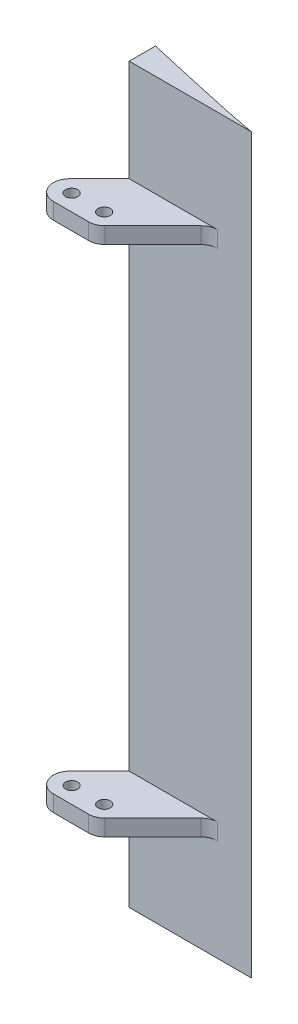
from build123d import *

# Parameters (mm, degrees)
BOSS_EXTRUDE1_DEPTH = 100
CUT_EXTRUDE4_DEPTH  = 100
SKETCH4_W           = 10
SKETCH4_H           = 2
BOSS_EXTRUDE2_DEPTH = 10
FILLET2_R           = 2
SKETCH6_R           = 0.75
CUT_EXTRUDE5_DEPTH  = 110


with BuildPart() as part:
    # Sketch1 → Boss-Extrude1 (new body)
    with BuildSketch(Plane(origin=(0, 0, 0), x_dir=(1, 0, 0), z_dir=(0, 1, 0))):
        with BuildLine():
            Line((-23.835160585, 0), (26.164839415, 0))
            add(Edge.make_bspline(
                [(-24.267578895, 1.256220546), (-22.278212262, 3.553586128), (-18.738393104, 4.793268312), (-8.850120496, 5.774851838), (4.13271293, 5.525012752), (19.211918986, 1.162580188), (26.164839415, 0)],
                knots=[0.021997225, 0.021997225, 0.021997225, 0.021997225, 0.155271246, 0.206186057, 0.531145331, 1, 1, 1, 1], degree=3))
            add(Edge.make_bspline(
                [(-24.267578895, 1.256220546), (-25.367081291, 0.124338635), (-23.835160585, 0)],
                knots=[0, 0, 0, 1, 1, 1], degree=2))
        make_face()
    extrude(amount=BOSS_EXTRUDE1_DEPTH)

    # Sketch2 → Cut-Extrude4 (cut)
    with BuildSketch(Plane.XY.offset(10)):
        Polygon((26.164839415, 95), (11.164839415, 95), (11.164839415, 5), (26.164839415, 5), (26.164839415, 0), (-24.726990199, 0), (-24.726990199, 100), (26.164839415, 100), align=None)
    extrude(amount=-CUT_EXTRUDE4_DEPTH, mode=Mode.SUBTRACT)

    # Sketch4 → Boss-Extrude2 (add, along a direction that is not the sketch's normal)
    with BuildSketch(Plane.XY):
        with Locations((16.164839415, 81.5)):
            Rectangle(SKETCH4_W, SKETCH4_H)
        with Locations((16.164839415, 18.5)):
            Rectangle(SKETCH4_W, SKETCH4_H)
    extrude(amount=BOSS_EXTRUDE2_DEPTH, dir=(-0.7071067811865557, 0, 0.7071067811865395))

    # Fillet2
    fillet2_edges = [part.edges().sort_by_distance(p)[0] for p in [
        (21.164839415, 18.5, 0),
        (14.093771603, 18.5, 7.071067812),
        (4.093771603, 18.5, 7.071067812),
        (21.164839415, 81.5, 0),
        (14.093771603, 81.5, 7.071067812),
        (4.093771603, 81.5, 7.071067812),
    ]]
    fillet(fillet2_edges, radius=FILLET2_R)

    # Sketch6 → Cut-Extrude5 (cut)
    with BuildSketch(Plane(origin=(0, 82.5, 0), x_dir=(1, 0, 0), z_dir=(0, 1, 0))):
        with Locations(Location((9.164839415, -5.071067812, 0), (0, 0, 270))):
            Circle(SKETCH6_R)
        with Locations(Location((13.164839415, -5.071067812, 0), (0, 0, 270))):
            Circle(SKETCH6_R)
    extrude(amount=-CUT_EXTRUDE5_DEPTH, mode=Mode.SUBTRACT)


solid = part.part
